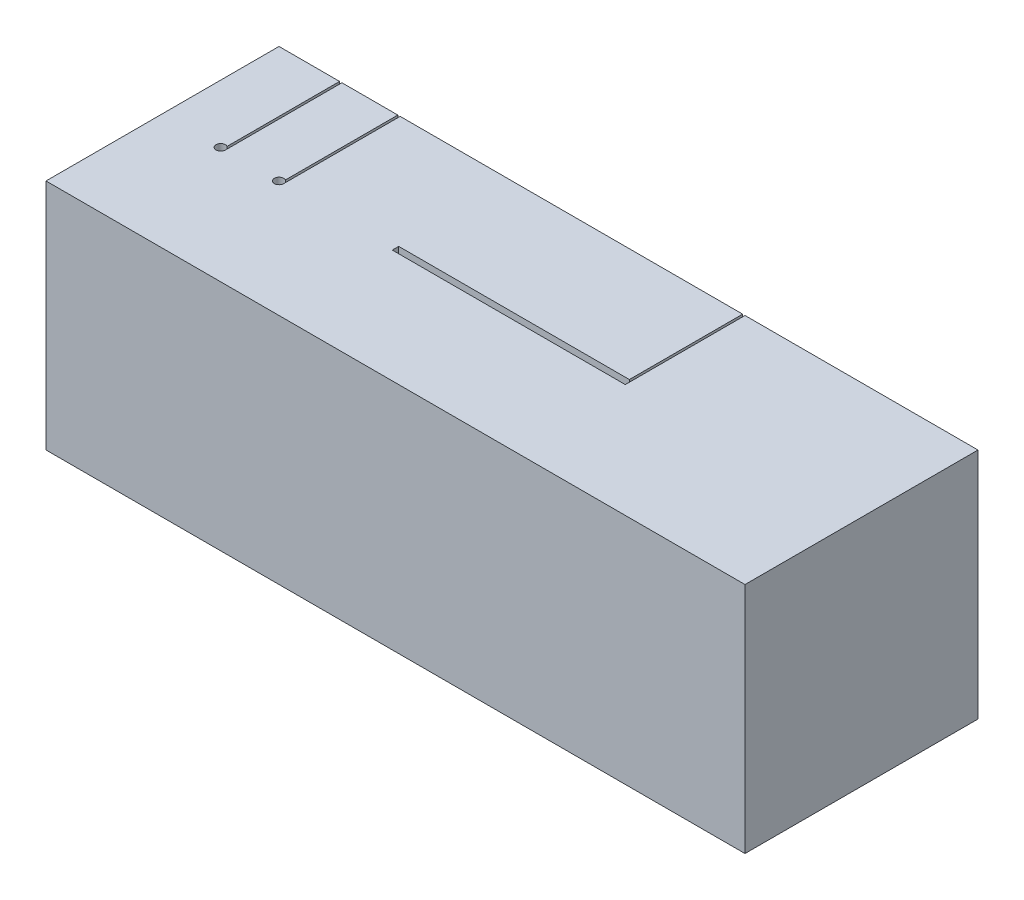
from build123d import *

# Parameters (mm, degrees)
SKETCH_1_W          = 60
SKETCH_1_H          = 20
EXTRUDE_1_DEPTH     = 20
SKETCH_2_W          = 20
SKETCH_2_H          = 0.55
CUT_EXTRUDE_1_DEPTH = 67.332495807
SKETCH_3_R          = 0.4
CUT_EXTRUDE_2_DEPTH = 67.332495807
SKETCH_4_W          = 0.2
SKETCH_4_H          = 10
SKETCH_4_H_2        = 9.725
CUT_EXTRUDE_3_DEPTH = 67.332495807


with BuildPart() as part:
    # 草图1 → 凸台-拉伸1 (new body)
    with BuildSketch(Plane.XY):
        with Locations((30, 10)):
            Rectangle(SKETCH_1_W, SKETCH_1_H)
    extrude(amount=EXTRUDE_1_DEPTH)

    # 草图2 → 切除-拉伸1 (cut, through all)
    with BuildSketch(Plane(origin=(0, 20, 0), x_dir=(1, 0, 0), z_dir=(0, 1, 0))):
        with Locations((30, -10)):
            Rectangle(SKETCH_2_W, SKETCH_2_H)
    extrude(amount=-CUT_EXTRUDE_1_DEPTH, mode=Mode.SUBTRACT)

    # 草图3 → 切除-拉伸2 (cut, through all)
    with BuildSketch(Plane(origin=(0, 20, 0), x_dir=(1, 0, 0), z_dir=(0, 1, 0))):
        with Locations(Location((5, -10, 0), (0, 0, 270))):
            Circle(SKETCH_3_R)
        with Locations(Location((10, -10, 0), (0, 0, 270))):
            Circle(SKETCH_3_R)
    extrude(amount=-CUT_EXTRUDE_2_DEPTH, mode=Mode.SUBTRACT)

    # 草图4 → 切除-拉伸3 (cut, through all)
    with BuildSketch(Plane.XZ):
        with Locations((5.3, 5)):
            Rectangle(SKETCH_4_W, SKETCH_4_H)
        with Locations((10.3, 5)):
            Rectangle(SKETCH_4_W, SKETCH_4_H)
        with Locations((39.9, 4.8625)):
            Rectangle(SKETCH_4_W, SKETCH_4_H_2)
    extrude(amount=-CUT_EXTRUDE_3_DEPTH, mode=Mode.SUBTRACT)


solid = part.part
